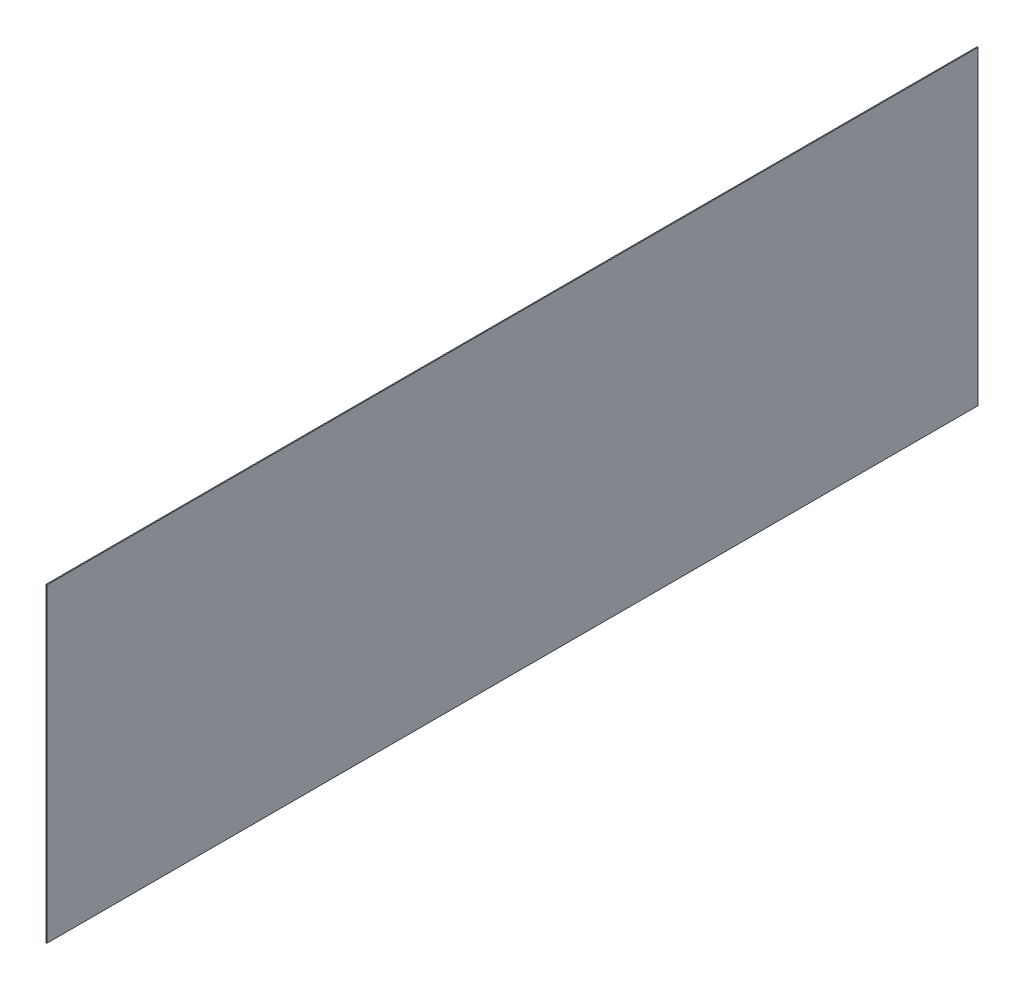
from build123d import *

# Parameters (mm, degrees)
SKETCH1_W   = 1920
SKETCH1_H   = 640
THICKEN1_T1 = 2


with BuildPart() as body_1:
    # Sketch1 → Surface-Plane1: a flat surface bounded by the sketch
    with BuildSketch(Plane(origin=(0, 0, 0), x_dir=(0, 0, -1), z_dir=(1, 0, 0)), mode=Mode.PRIVATE) as surface_plane1_1_region:
        Rectangle(SKETCH1_W, SKETCH1_H)
    surface_plane1_1 = surface_plane1_1_region.sketch.faces()[0]
    add(Solid.thicken(surface_plane1_1, THICKEN1_T1))


solid = body_1.part
